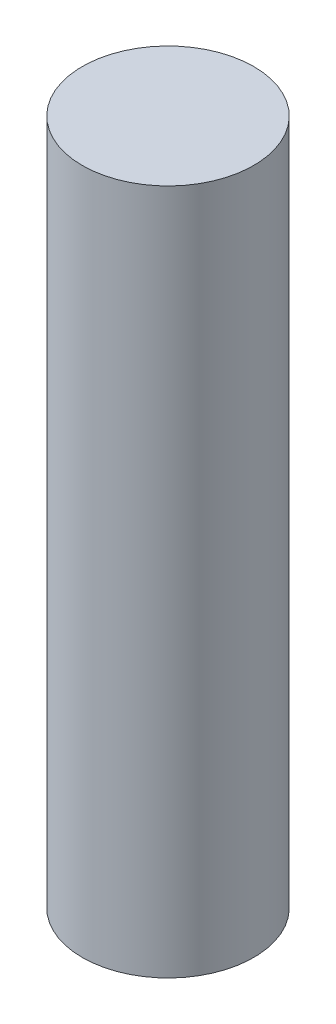
from build123d import *

# Parameters (mm, degrees)
SCHIZZO1_R                   = 6.25
ESTRUSIONE_ESTRUSIONE1_DEPTH = 50


with BuildPart() as part:
    # Schizzo1 → Estrusione-Estrusione1 (new body)
    with BuildSketch(Plane(origin=(0, 0, 0), x_dir=(1, 0, 0), z_dir=(0, 1, 0))):
        with Locations(Location((0, 0, 0), (0, 0, 270))):
            Circle(SCHIZZO1_R)
    extrude(amount=ESTRUSIONE_ESTRUSIONE1_DEPTH)


solid = part.part
